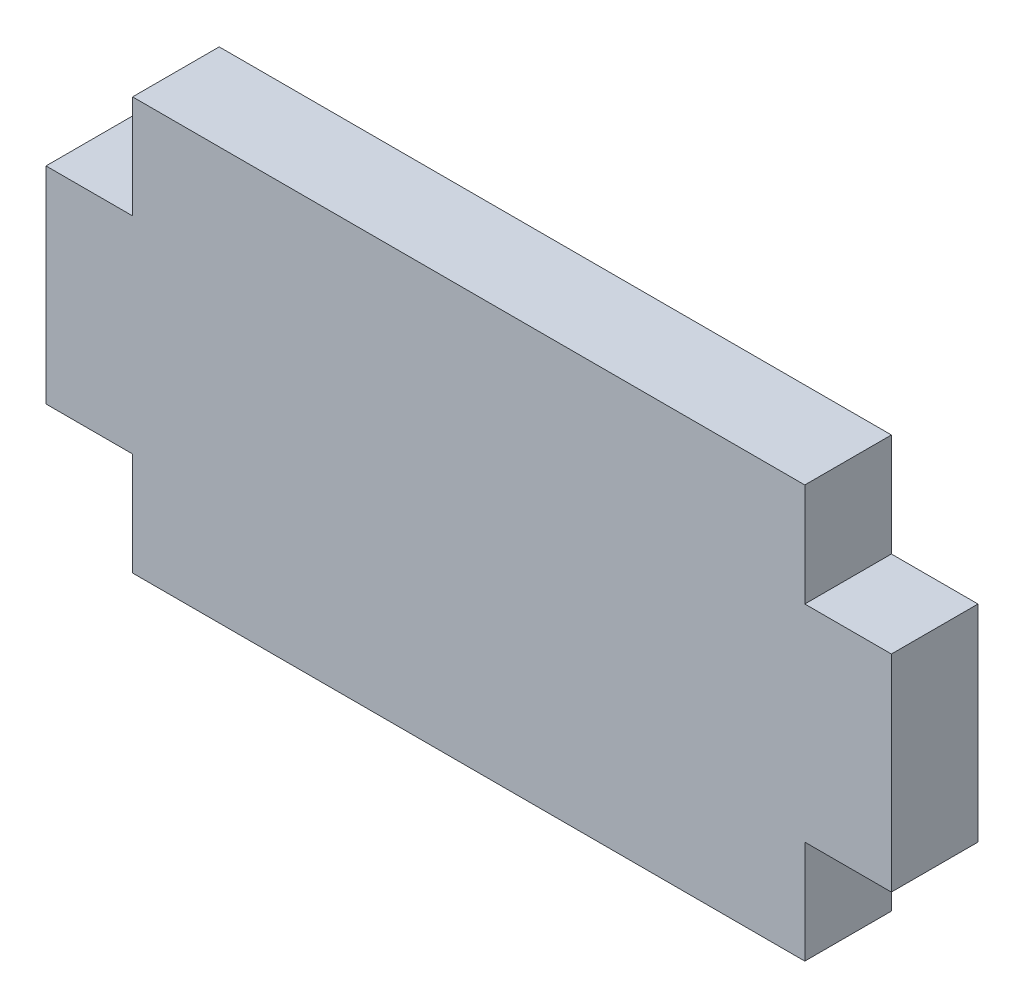
from build123d import *

# Parameters (mm, degrees)
SKETCH1_W           = 52.07
SKETCH1_H           = 25.4
BOSS_EXTRUDE1_DEPTH = 5.334
SKETCH2_W           = 5.334
SKETCH2_H           = 6.35
CUT_EXTRUDE1_DEPTH  = 115.506797946


with BuildPart() as part:
    # Sketch1 → Boss-Extrude1 (new body)
    with BuildSketch(Plane.XY):
        with Locations((-86.805766511, -6.016747393)):
            Rectangle(SKETCH1_W, SKETCH1_H)
    extrude(amount=BOSS_EXTRUDE1_DEPTH)

    # Sketch2 → Cut-Extrude1 (cut, through all)
    with BuildSketch(Plane.XY.offset(5.334)):
        with Locations((-63.437766511, -15.541747393)):
            Rectangle(SKETCH2_W, SKETCH2_H)
        with Locations((-110.173766511, 3.508252607)):
            Rectangle(SKETCH2_W, SKETCH2_H)
        with Locations((-110.173766511, -15.541747393)):
            Rectangle(SKETCH2_W, SKETCH2_H)
        with Locations((-63.437766511, 3.508252607)):
            Rectangle(SKETCH2_W, SKETCH2_H)
    extrude(amount=-CUT_EXTRUDE1_DEPTH, mode=Mode.SUBTRACT)


solid = part.part
